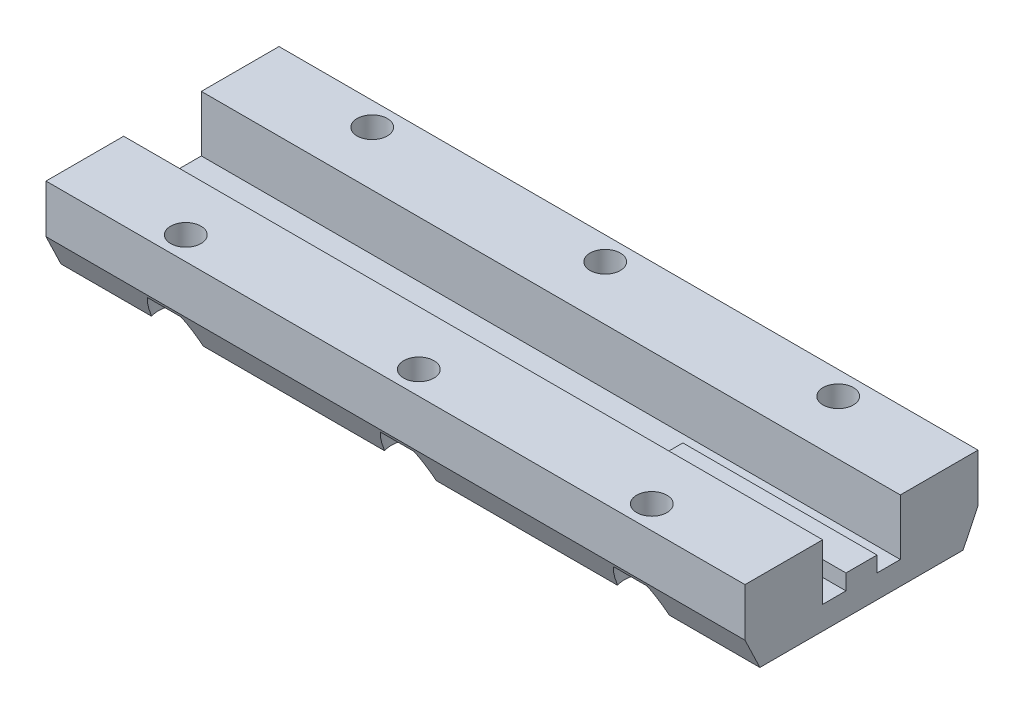
from build123d import *

# Parameters (mm, degrees)
EXTRUDE_1_DEPTH     = 90
EXTRUDE_1_2_DEPTH   = 90
SKETCH_3_R          = 1.95
CUT_EXTRUDE_1_DEPTH = 92.809803398
SKETCH_5_W          = 25
SKETCH_5_H          = 5
EXTRUDE_2_DEPTH     = 2
SKETCH_6_R          = 3.5
CUT_EXTRUDE_2_DEPTH = 3.5


with BuildPart() as part:
    # 스케치1 → 보스-돌출1 (new body)
    with BuildSketch(Plane(origin=(0, 0, 0), x_dir=(0, 0, -1), z_dir=(1, 0, 0))):
        Polygon((-15, 0), (-15, -6.2), (-13.081136552, -10.2), (-1.95, -10.2), (-1.95, -7.2), (-5, -7.2), (-5, 0), align=None)
    extrude(amount=EXTRUDE_1_DEPTH)


with BuildPart() as body_2:
    # 스케치1 → Extrude 1 2 (new body)
    with BuildSketch(Plane(origin=(0, 0, 0), x_dir=(0, 0, -1), z_dir=(1, 0, 0))):
        Polygon((13.081136552, -10.2), (15, -6.2), (15, 0), (5, 0), (5, -7.2), (1.95, -7.2), (1.95, -10.2), align=None)
    extrude(amount=EXTRUDE_1_2_DEPTH)


with BuildPart() as cut_extrude_1_tool:
    # 스케치3 → 컷-돌출1 (new, through all)
    with BuildSketch(Plane.XZ.offset(10.2)):
        with Locations(Location((15, 12, 0), (0, 0, 270))):
            Circle(SKETCH_3_R)
        with Locations(Location((15, -12, 0), (0, 0, 270))):
            Circle(SKETCH_3_R)
        with Locations(Location((45, -12, 0), (0, 0, 270))):
            Circle(SKETCH_3_R)
        with Locations(Location((75, -12, 0), (0, 0, 270))):
            Circle(SKETCH_3_R)
        with Locations((110, -12)):
            Circle(SKETCH_3_R)
        with Locations((110, 12)):
            Circle(SKETCH_3_R)
        with Locations(Location((75, 12, 0), (0, 0, 270))):
            Circle(SKETCH_3_R)
        with Locations(Location((45, 12, 0), (0, 0, 270))):
            Circle(SKETCH_3_R)
        with BuildLine():
            ThreePointArc((13.377149497, -13.081136552), (15, -13.95), (16.622850503, -13.081136552))
            Line((16.622850503, -13.081136552), (13.377149497, -13.081136552))
        make_face()
        with BuildLine():
            Line((13.377149497, -13.081136552), (16.622850503, -13.081136552))
            ThreePointArc((16.622850503, -13.081136552), (16.866421507, -12.564774963), (16.95, -12))
            ThreePointArc((16.95, -12), (14.435225037, -10.133578493), (13.377149497, -13.081136552))
        make_face()
        with BuildLine():
            ThreePointArc((43.377149497, -13.081136552), (45, -13.95), (46.622850503, -13.081136552))
            Line((46.622850503, -13.081136552), (43.377149497, -13.081136552))
        make_face()
        with BuildLine():
            Line((43.377149497, -13.081136552), (46.622850503, -13.081136552))
            ThreePointArc((46.622850503, -13.081136552), (46.866421507, -12.564774963), (46.95, -12))
            ThreePointArc((46.95, -12), (44.435225037, -10.133578493), (43.377149497, -13.081136552))
        make_face()
        with BuildLine():
            ThreePointArc((76.622850503, -13.081136552), (76.866421507, -12.564774963), (76.95, -12))
            ThreePointArc((76.95, -12), (74.435225037, -10.133578493), (73.377149497, -13.081136552))
            Line((73.377149497, -13.081136552), (76.622850503, -13.081136552))
        make_face()
        with BuildLine():
            Line((76.622850503, -13.081136552), (73.377149497, -13.081136552))
            ThreePointArc((73.377149497, -13.081136552), (75, -13.95), (76.622850503, -13.081136552))
        make_face()
    extrude(amount=-CUT_EXTRUDE_1_DEPTH)


with BuildPart() as part_1:
    add(part.part)

    # 컷-돌출1: cut by cut_extrude_1_tool
    add(cut_extrude_1_tool.part, mode=Mode.SUBTRACT)



with BuildPart() as body_2_1:
    add(body_2.part)

    # 컷-돌출1: cut by cut_extrude_1_tool
    add(cut_extrude_1_tool.part, mode=Mode.SUBTRACT)


with BuildPart() as part_2:
    add(part_1.part)

    add(body_2_1.part)  # 보스-돌출2 merges body 2
    # 스케치5 → 보스-돌출2 (add, symmetric)
    with BuildSketch(Plane.XY):
        with Locations((77.5, -7.7)):
            Rectangle(SKETCH_5_W, SKETCH_5_H)
    extrude(amount=EXTRUDE_2_DEPTH, both=True)

    # 스케치6 → 컷-돌출2 (cut)
    with BuildSketch(Plane.XZ.offset(10.2)):
        with Locations((15, 12)):
            Circle(SKETCH_6_R)
        with Locations((15, -12)):
            Circle(SKETCH_6_R)
        with Locations((45, 12)):
            Circle(SKETCH_6_R)
        with Locations((75, 12)):
            Circle(SKETCH_6_R)
        with Locations((75, -12)):
            Circle(SKETCH_6_R)
        with Locations((45, -12)):
            Circle(SKETCH_6_R)
    extrude(amount=-CUT_EXTRUDE_2_DEPTH, mode=Mode.SUBTRACT)


solid = part_2.part
